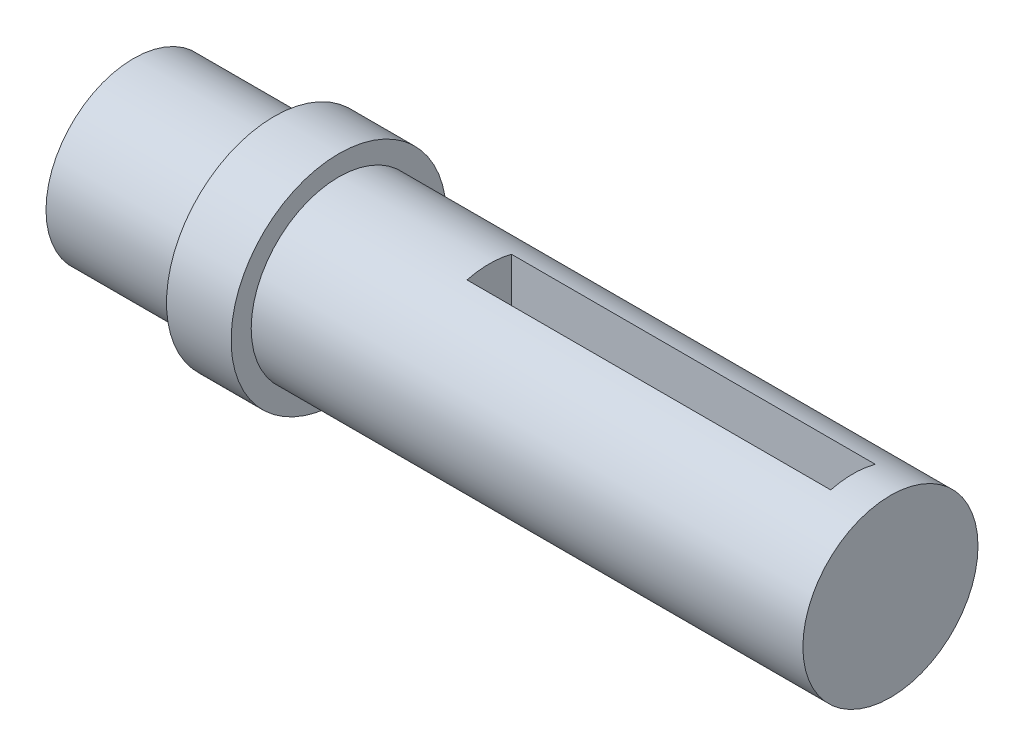
from build123d import *

# Parameters (mm, degrees)
CUT_EXTRUDE2_DEPTH      = 165.71500296
CUT_EXTRUDE2_DEPTH_BACK = 165.71500296
SKETCH3_W               = 77.6
SKETCH3_H               = 9.49


with BuildPart() as part:
    # Sketch1 → Revolve1 (revolve)
    with BuildSketch(Plane.XY, mode=Mode.PRIVATE) as revolve1_sk:
        Polygon((161.48, 0), (161.48, 18.68), (43.78, 18.68), (43.78, 22.97), (30, 22.97), (30, 18.68), (0, 18.68), (0, 0), align=None)
    revolve(revolve1_sk.sketch.rotate(Axis((0, 0, 0), (1, 0, 0)), 180), axis=Axis((0, 0, 0), (1, 0, 0)))

    # Sketch3 → Cut-Extrude2 (cut, two sides: drawn at the far end of the back side and taken through both)
    with BuildSketch(Plane(origin=(0, 0, 0), x_dir=(1, 0, 0), z_dir=(0, 1, 0)).offset(-CUT_EXTRUDE2_DEPTH_BACK)):
        with Locations((114.69, 0)):
            Rectangle(SKETCH3_W, SKETCH3_H)
    extrude(amount=CUT_EXTRUDE2_DEPTH + CUT_EXTRUDE2_DEPTH_BACK, mode=Mode.SUBTRACT)


solid = part.part
